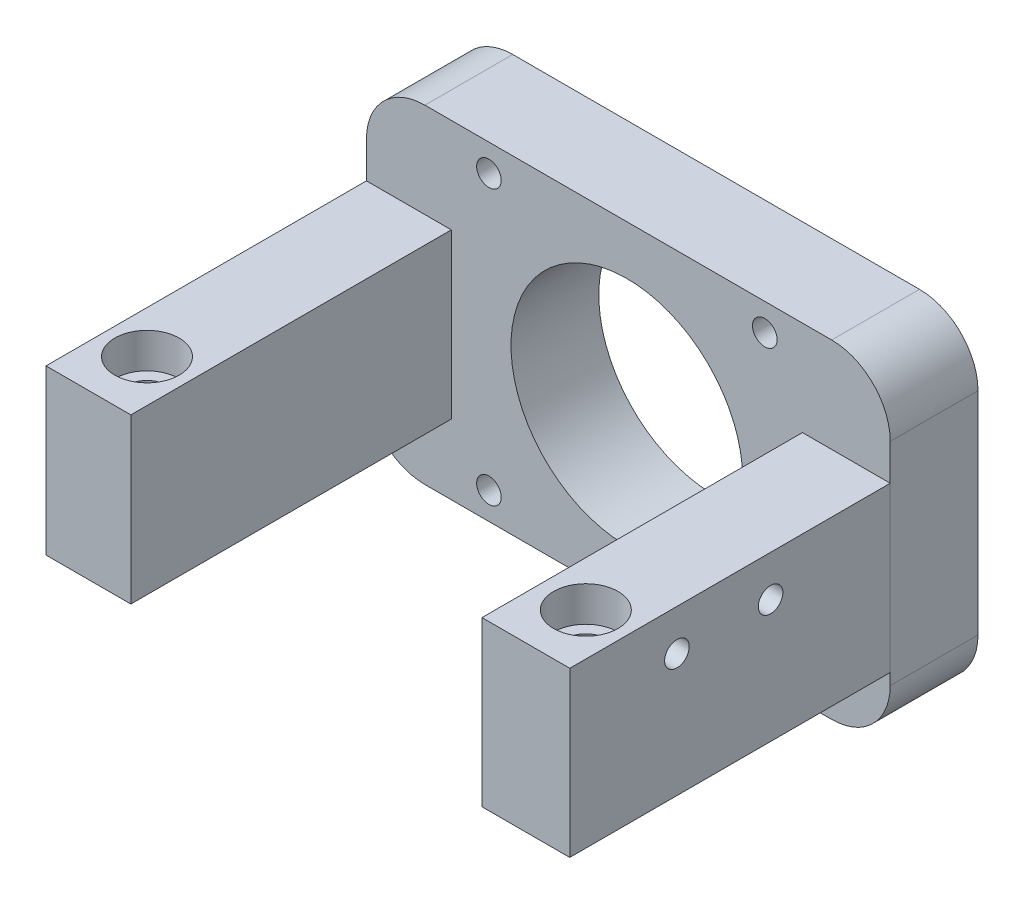
from build123d import *

# Parameters (mm, degrees)
SKETCH1_W                            = 89.5
SKETCH1_H                            = 56.15
SKETCH1_R                            = 19.8
BOSS_EXTRUDE1_DEPTH                  = 15
SKETCH2_W                            = 14.5
SKETCH2_H                            = 54.759929683
BOSS_EXTRUDE3_DEPTH                  = 28
SKETCH2_W_2                          = 15
BOSS_EXTRUDE3_2_DEPTH                = 28
SKETCH12_W                           = 2.1
SKETCH12_H                           = 15
M5X0_8_TAPPED_HOLE1_AT_2_COUNT       = 2
M5X0_8_TAPPED_HOLE1_AT_2_PITCH       = 47.140662914
M5X0_8_TAPPED_HOLE1_AT_3_COUNT       = 2
M5X0_8_TAPPED_HOLE1_AT_3_PITCH       = 66.489485635
M5X0_8_TAPPED_HOLE1_AT_4_COUNT       = 2
M5X0_8_TAPPED_HOLE1_AT_4_PITCH       = 46.89
FILLET1_R                            = 10
TAP_DRILL_FOR_M5X0_8_TAP2_AT_2_COUNT = 2
TAP_DRILL_FOR_M5X0_8_TAP2_AT_2_PITCH = 16


with BuildPart() as part:
    # Sketch1 → Boss-Extrude1 (new body)
    with BuildSketch(Plane.XY):
        with Locations((0.25, 0.125)):
            Rectangle(SKETCH1_W, SKETCH1_H)
        Circle(SKETCH1_R, mode=Mode.SUBTRACT)
    extrude(amount=BOSS_EXTRUDE1_DEPTH)

    # Sketch5 → Hole1 (revolve, cut)
    with BuildSketch(Plane(origin=(-37.155548207, -2, 0), x_dir=(0, 1, 0), z_dir=(1, 0, 0))):
        Polygon((0, 0), (0, 15), (3.25, 15), (3.25, 7), (5.5, 7), (5.5, 0), align=None)
    hole1 = revolve(axis=Axis((-37.155548207, -2, 110), (0, 0, -1)), mode=Mode.SUBTRACT)


with BuildPart() as body_2:
    # Sketch2 → Boss-Extrude3 (new body)
    with BuildSketch(Plane(origin=(0, -16, 0), x_dir=(1, 0, 0), z_dir=(0, 1, 0))):
        with Locations((-37.25, -42.379964842)):
            Rectangle(SKETCH2_W, SKETCH2_H)
    extrude(amount=BOSS_EXTRUDE3_DEPTH)

    # Sketch7 → Tap Drill for M6x1.0 Tap1 (revolve, cut)
    with BuildSketch(Plane(origin=(-37.155548207, -2, 0), x_dir=(0, 1, 0), z_dir=(1, 0, 0))):
        Polygon((0, 0), (0, 31.502151548), (2.5, 30), (2.5, 0), align=None)
    tap_drill_for_m6x1_0_tap1 = revolve(axis=Axis((-37.155548207, -2, -6.35), (0, 0, 1)), mode=Mode.SUBTRACT)

    # Sketch10 → CBORE for M6 SHCS1 (revolve, cut)
    with BuildSketch(Plane(origin=(-37.245608268, 12, 59.759929683), x_dir=(0, 0, 1), z_dir=(1, 0, 0))):
        Polygon((0, 0), (0, 28.001), (3.5, 28.001), (3.5, 6), (5.5, 6), (5.5, 0), align=None)
    cbore_for_m6_shcs1 = revolve(axis=Axis((-37.245608268, 18.35, 59.759929683), (0, -1, 0)), mode=Mode.SUBTRACT)


with BuildPart() as body_3:
    # Sketch2 → Boss-Extrude3 2 (new body)
    with BuildSketch(Plane(origin=(0, -16, 0), x_dir=(1, 0, 0), z_dir=(0, 1, 0))):
        with Locations((37.5, -42.379964842)):
            Rectangle(SKETCH2_W_2, SKETCH2_H)
    extrude(amount=BOSS_EXTRUDE3_2_DEPTH)


with BuildPart() as mirror1_tool:
    # Mirror1: Hole1, Tap Drill for M6x1.0 Tap1, CBORE for M6 SHCS1 across plane
    add(hole1.mirror(Plane(origin=(0.25, 0, 0), x_dir=(0, 0, 1), z_dir=(1, 0, 0))))
    add(tap_drill_for_m6x1_0_tap1.mirror(Plane(origin=(0.25, 0, 0), x_dir=(0, 0, 1), z_dir=(1, 0, 0))))
    add(cbore_for_m6_shcs1.mirror(Plane(origin=(0.25, 0, 0), x_dir=(0, 0, 1), z_dir=(1, 0, 0))))


with BuildPart() as part_1:
    add(part.part)

    # Mirror1: cut by mirror1_tool
    add(mirror1_tool.part, mode=Mode.SUBTRACT)

    # Sketch12 → M5x0.8 Tapped Hole1 (revolve, cut)
    with BuildSketch(Plane(origin=(-23.57, -23.32, 0), x_dir=(0, 1, 0), z_dir=(1, 0, 0))):
        with Locations((1.05, 7.5)):
            Rectangle(SKETCH12_W, SKETCH12_H)
    m5x0_8_tapped_hole1 = revolve(axis=Axis((-23.57, -23.32, -6.35), (0, 0, 1)), mode=Mode.SUBTRACT)

    # M5x0.8 Tapped Hole1 at 2: M5x0.8 Tapped Hole1 ×2
    with Locations(*[Vector(0.9999859375269115, -0.005303277140045137, 0) * (i * M5X0_8_TAPPED_HOLE1_AT_2_PITCH) for i in range(1, M5X0_8_TAPPED_HOLE1_AT_2_COUNT)]):
        add(m5x0_8_tapped_hole1, mode=Mode.SUBTRACT)

    # M5x0.8 Tapped Hole1 at 3: M5x0.8 Tapped Hole1 ×2
    with Locations(*[Vector(0.7089842784890216, 0.705224285497459, 0) * (i * M5X0_8_TAPPED_HOLE1_AT_3_PITCH) for i in range(1, M5X0_8_TAPPED_HOLE1_AT_3_COUNT)]):
        add(m5x0_8_tapped_hole1, mode=Mode.SUBTRACT)

    # M5x0.8 Tapped Hole1 at 4: M5x0.8 Tapped Hole1 ×2
    with Locations(*[(0, i * M5X0_8_TAPPED_HOLE1_AT_4_PITCH, 0) for i in range(1, M5X0_8_TAPPED_HOLE1_AT_4_COUNT)]):
        add(m5x0_8_tapped_hole1, mode=Mode.SUBTRACT)

    # Fillet1
    fillet1_edges = [part_1.edges().sort_by_distance(p)[0] for p in [
        (-44.5, 28.2, 7.5),
        (45, 28.2, 7.5),
        (45, -27.95, 7.5),
        (-44.5, -27.95, 7.5),
    ]]
    fillet(fillet1_edges, radius=FILLET1_R)


with BuildPart() as body_3_1:
    add(body_3.part)

    # Mirror1: cut by mirror1_tool
    add(mirror1_tool.part, mode=Mode.SUBTRACT)

    # Sketch15 → Tap Drill for M5x0.8 Tap2 (revolve, cut)
    with BuildSketch(Plane(origin=(45, 5, 35.44487549), x_dir=(0, 0, -1), z_dir=(0, 1, 0))):
        Polygon((0, 0), (0, 21.2618073), (2.1, 20), (2.1, 0), align=None)
    tap_drill_for_m5x0_8_tap2 = revolve(axis=Axis((51.35, 5, 35.44487549), (-1, 0, 0)), mode=Mode.SUBTRACT)

    # Tap Drill for M5x0.8 Tap2 at 2: Tap Drill for M5x0.8 Tap2 ×2
    with Locations(*[(0, 0, i * TAP_DRILL_FOR_M5X0_8_TAP2_AT_2_PITCH) for i in range(1, TAP_DRILL_FOR_M5X0_8_TAP2_AT_2_COUNT)]):
        add(tap_drill_for_m5x0_8_tap2, mode=Mode.SUBTRACT)


solid = Compound([body_2.part, part_1.part, body_3_1.part])
